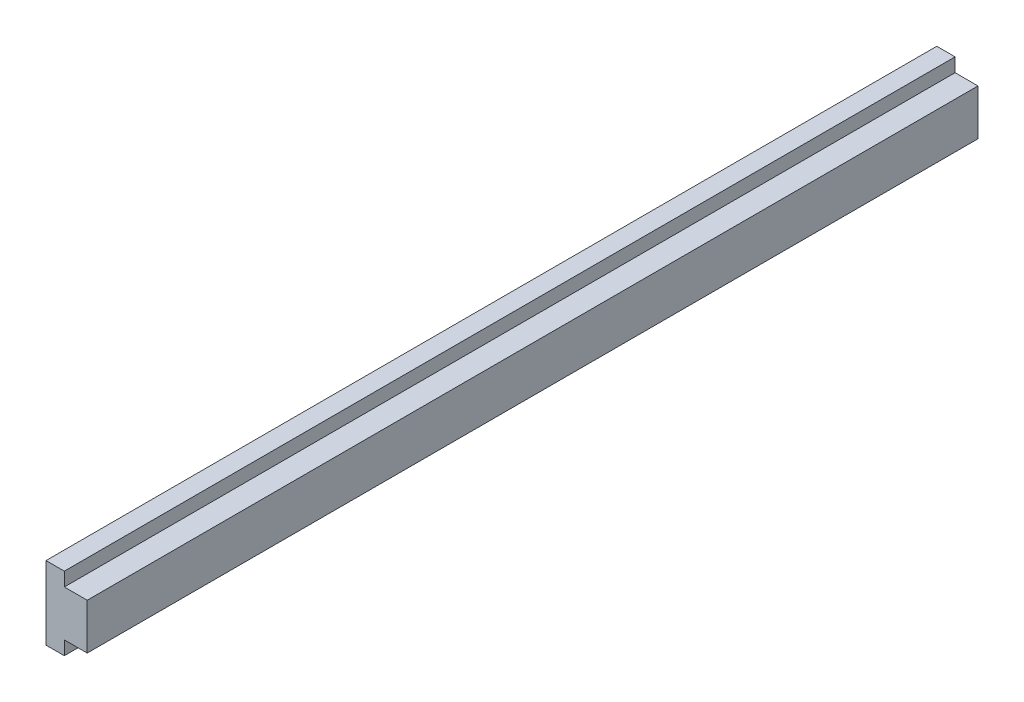
from build123d import *

# Parameters (mm, degrees)
SKETCH1_W           = 10
SKETCH1_H           = 5
SKETCH1_W_2         = 16
SKETCH1_H_2         = 4
BOSS_EXTRUDE1_DEPTH = 194.5
SKETCH2_W           = 6.1
SKETCH2_H           = 6.1
CUT_EXTRUDE1_DEPTH  = 20


with BuildPart() as part:
    # Sketch1 → Boss-Extrude1 (new body)
    with BuildSketch(Plane(origin=(0, 0, 0), x_dir=(0, 1, 0), z_dir=(0, 0, 1))):
        with Locations((0, -4.5)):
            Rectangle(SKETCH1_W, SKETCH1_H)
        Rectangle(SKETCH1_W_2, SKETCH1_H_2)
    extrude(amount=-BOSS_EXTRUDE1_DEPTH)

    # Sketch2 → Cut-Extrude1 (cut)
    with BuildSketch(Plane(origin=(0, 0, -194.5), x_dir=(1, 0, 0), z_dir=(0, 0, -1))):
        with Locations((2.5, 0)):
            Rectangle(SKETCH2_W, SKETCH2_H)
    extrude(amount=-CUT_EXTRUDE1_DEPTH, mode=Mode.SUBTRACT)


solid = part.part
